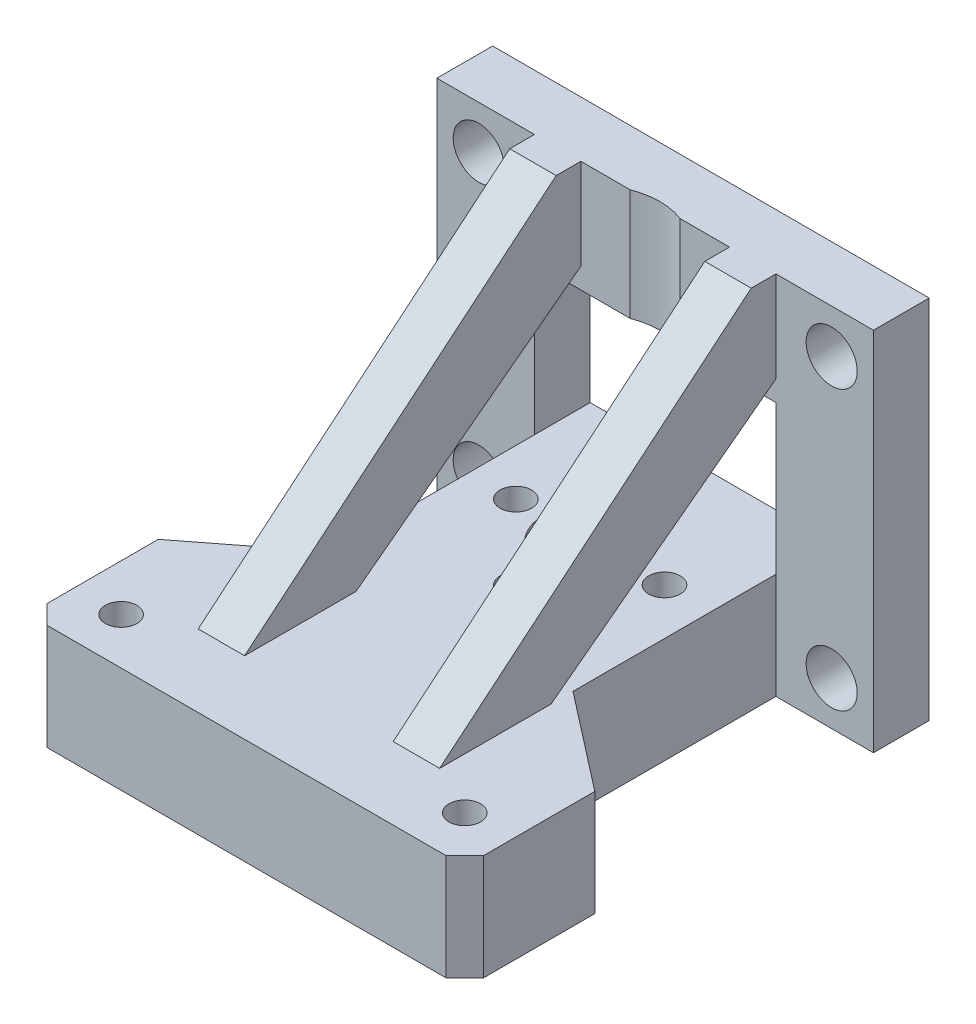
from build123d import *

# Parameters (mm, degrees)
SKETCH1_W                = 47
SKETCH1_H                = 39.4
BOSS_EXTRUDE1_DEPTH      = 50
SKETCH3_W                = 10.5
SKETCH3_H                = 30
CUT_EXTRUDE1_DEPTH       = 50
SKETCH19_R               = 5
CUT_EXTRUDE6_DEPTH       = 68.857276692
M5_CLEARANCE_HOLE1_D     = 5.5
M5_CLEARANCE_HOLE1_DEPTH = 6
SKETCH25_R               = 7.5
CUT_EXTRUDE7_DEPTH       = 28
CUT_EXTRUDE8_DEPTH       = 28
SKETCH27_W               = 26
SKETCH27_H               = 16
CUT_EXTRUDE9_DEPTH       = 28
CUT_EXTRUDE10_REACH      = 69.857
SKETCH28_R               = 1.7
BOSS_EXTRUDE2_DEPTH      = 26
SKETCH30_W               = 16
SKETCH30_H               = 41.736735488
CUT_EXTRUDE11_DEPTH      = 28
BOSS_EXTRUDE3_DEPTH      = 11.4
CHAMFER1_SIZE            = 2


with BuildPart() as part:
    # Sketch1 → Boss-Extrude1 (new body)
    with BuildSketch(Plane.XY):
        Rectangle(SKETCH1_W, SKETCH1_H)
    extrude(amount=BOSS_EXTRUDE1_DEPTH)

    # Sketch3 → Cut-Extrude1 (cut)
    with BuildSketch(Plane(origin=(0, 19.7, 0), x_dir=(1, 0, 0), z_dir=(0, 1, 0))):
        with Locations((18.25, -21)):
            Rectangle(SKETCH3_W, SKETCH3_H)
        with Locations((-18.25, -21)):
            Rectangle(SKETCH3_W, SKETCH3_H)
    extrude(amount=-CUT_EXTRUDE1_DEPTH, mode=Mode.SUBTRACT)

    # Sketch19 → Cut-Extrude6 (cut, through all)
    with BuildSketch(Plane.XZ.offset(19.7)):
        with Locations(Location((0, 13, 0), (0, 0, 270))):
            Circle(SKETCH19_R)
    extrude(amount=-CUT_EXTRUDE6_DEPTH, mode=Mode.SUBTRACT)

    # M5 Clearance Hole1
    with Locations(Plane(origin=(0, 0, 0), x_dir=(-1, 0, 0), z_dir=(0, 0, -1))):
        with Locations((-19, -15), (-19, 15), (19, 15), (19, -15)):
            Hole(M5_CLEARANCE_HOLE1_D / 2, depth=M5_CLEARANCE_HOLE1_DEPTH)

    # Sketch25 → Cut-Extrude7 (cut)
    with BuildSketch(Plane(origin=(0, 19.7, 0), x_dir=(1, 0, 0), z_dir=(0, 1, 0))):
        with Locations(Location((0, -13, 0), (0, 0, 270))):
            Circle(SKETCH25_R)
    extrude(amount=-CUT_EXTRUDE7_DEPTH, mode=Mode.SUBTRACT)

    # Sketch26 → Cut-Extrude8 (cut)
    with BuildSketch(Plane(origin=(0, 19.7, 0), x_dir=(1, 0, 0), z_dir=(0, 1, 0))):
        Polygon((13, -6), (13, -36), (23.5, -36), (23.5, -50), (-23.5, -50), (-23.5, -36), (-13, -36), (-13, -6), align=None)
    extrude(amount=-CUT_EXTRUDE8_DEPTH, mode=Mode.SUBTRACT)

    # Sketch27 → Cut-Extrude9 (cut)
    with BuildSketch(Plane.XY.offset(6)):
        with Locations((0, -0.3)):
            Rectangle(SKETCH27_W, SKETCH27_H)
    extrude(amount=-CUT_EXTRUDE9_DEPTH, mode=Mode.SUBTRACT)

    # Sketch28 → Cut-Extrude10 (cut, up to next)
    with BuildSketch(Plane.XZ.offset(19.7), mode=Mode.PRIVATE) as cut_extrude10_sk1:
        with Locations(Location((0, 21, 0), (0, 0, 270))):
            Circle(SKETCH28_R)
    cut_extrude10_tool1 = extrude(cut_extrude10_sk1.sketch, amount=-CUT_EXTRUDE10_REACH, mode=Mode.PRIVATE) & part.part
    # Sketch28 → Cut-Extrude10 (cut, up to next)
    with BuildSketch(Plane.XZ.offset(19.7), mode=Mode.PRIVATE) as cut_extrude10_sk2:
        with Locations(Location((8, 13, 0), (0, 0, 270))):
            Circle(SKETCH28_R)
    cut_extrude10_tool2 = extrude(cut_extrude10_sk2.sketch, amount=-CUT_EXTRUDE10_REACH, mode=Mode.PRIVATE) & part.part
    # Sketch28 → Cut-Extrude10 (cut, up to next)
    with BuildSketch(Plane.XZ.offset(19.7), mode=Mode.PRIVATE) as cut_extrude10_sk3:
        with Locations(Location((0, 5, 0), (0, 0, 270))):
            Circle(SKETCH28_R)
    cut_extrude10_tool3 = extrude(cut_extrude10_sk3.sketch, amount=-CUT_EXTRUDE10_REACH, mode=Mode.PRIVATE) & part.part
    # Sketch28 → Cut-Extrude10 (cut, up to next)
    with BuildSketch(Plane.XZ.offset(19.7), mode=Mode.PRIVATE) as cut_extrude10_sk4:
        with Locations(Location((-8, 13, 0), (0, 0, 270))):
            Circle(SKETCH28_R)
    cut_extrude10_tool4 = extrude(cut_extrude10_sk4.sketch, amount=-CUT_EXTRUDE10_REACH, mode=Mode.PRIVATE) & part.part
    # Sketch28 → Cut-Extrude10 (cut, up to next)
    with BuildSketch(Plane.XZ.offset(19.7), mode=Mode.PRIVATE) as cut_extrude10_sk5:
        with Locations(Location((-18.5, 45, 0), (0, 0, 270))):
            Circle(SKETCH28_R)
    cut_extrude10_tool5 = extrude(cut_extrude10_sk5.sketch, amount=-CUT_EXTRUDE10_REACH, mode=Mode.PRIVATE) & part.part
    # Sketch28 → Cut-Extrude10 (cut, up to next)
    with BuildSketch(Plane.XZ.offset(19.7), mode=Mode.PRIVATE) as cut_extrude10_sk6:
        with Locations(Location((18.5, 45, 0), (0, 0, 270))):
            Circle(SKETCH28_R)
    cut_extrude10_tool6 = extrude(cut_extrude10_sk6.sketch, amount=-CUT_EXTRUDE10_REACH, mode=Mode.PRIVATE) & part.part
    add(cut_extrude10_tool1.solids().sort_by_distance((0, -19.7, 21))[0], mode=Mode.SUBTRACT)
    add(cut_extrude10_tool2.solids().sort_by_distance((8, -19.7, 13))[0], mode=Mode.SUBTRACT)
    add(cut_extrude10_tool3.solids().sort_by_distance((0, -19.7, 5))[0], mode=Mode.SUBTRACT)
    add(cut_extrude10_tool4.solids().sort_by_distance((-8, -19.7, 13))[0], mode=Mode.SUBTRACT)
    add(cut_extrude10_tool5.solids().sort_by_distance((-18.5, -19.7, 45))[0], mode=Mode.SUBTRACT)
    add(cut_extrude10_tool6.solids().sort_by_distance((18.5, -19.7, 45))[0], mode=Mode.SUBTRACT)

    # Sketch29 → Boss-Extrude2 (add)
    with BuildSketch(Plane(origin=(13, 0, 0), x_dir=(0, 0, -1), z_dir=(1, 0, 0))):
        Polygon((-42.205748108, -8.3), (-30.205748108, -8.3), (-6, 9.919793382), (-6, 19.7), (-8.659491381, 19.7), align=None)
    extrude(amount=-BOSS_EXTRUDE2_DEPTH)

    # Sketch30 → Cut-Extrude11 (cut)
    with BuildSketch(Plane(origin=(0, 19.7, 0), x_dir=(1, 0, 0), z_dir=(0, 1, 0))):
        with Locations((0, -26.868367744)):
            Rectangle(SKETCH30_W, SKETCH30_H)
    extrude(amount=-CUT_EXTRUDE11_DEPTH, mode=Mode.SUBTRACT)

    # Sketch31 → Boss-Extrude3 (add)
    with BuildSketch(Plane.XZ.offset(19.7)):
        Polygon((-23.5, 36), (-13, 36), (-13, 27.846939537), align=None)
        Polygon((13, 36), (13, 27.846939537), (23.5, 36), align=None)
    extrude(amount=-BOSS_EXTRUDE3_DEPTH)

    # Chamfer1
    chamfer1_edges = [part.edges().sort_by_distance(p)[0] for p in [
        (23.5, -14, 50),
        (-23.5, -14, 50),
    ]]
    chamfer(chamfer1_edges, length=CHAMFER1_SIZE)


solid = part.part
